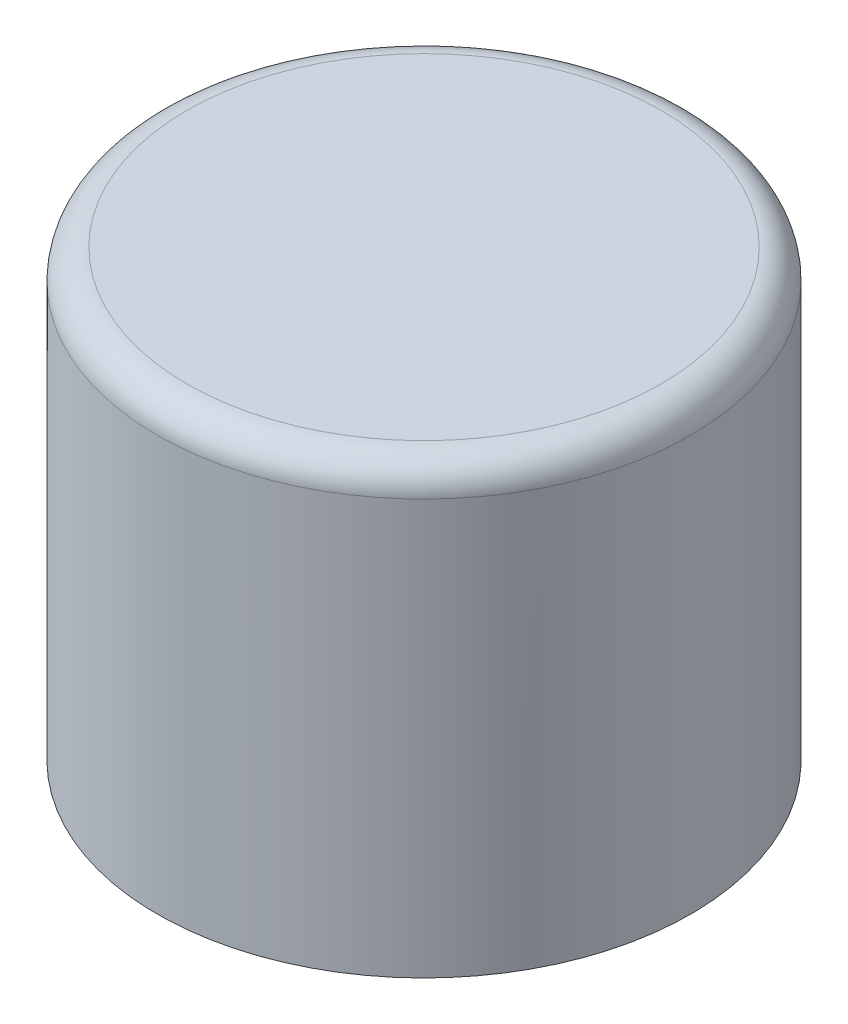
from build123d import *

# Parameters (mm, degrees)
FILLET1_R = 1


with BuildPart() as part:
    # Sketch1 → Revolve1 (revolve)
    with BuildSketch(Plane.XY, mode=Mode.PRIVATE) as revolve1_sk:
        Polygon((4, 0), (8, 0), (8, -12.5), (9, -12.5), (9, 0), (9, 2.5), (0, 2.5), (0, 0), (2.5, 0), (2.5, -4), (4, -4), align=None)
    revolve(revolve1_sk.sketch.rotate(Axis((0, 0, 0), (0, 1, 0)), 90), axis=Axis((0, 0, 0), (0, 1, 0)))

    # Fillet1
    fillet1_edges = [part.edges().sort_by_distance(p)[0] for p in [
        (0, 0, 8),
        (0, 2.5, 9),
    ]]
    fillet(fillet1_edges, radius=FILLET1_R)


solid = part.part
